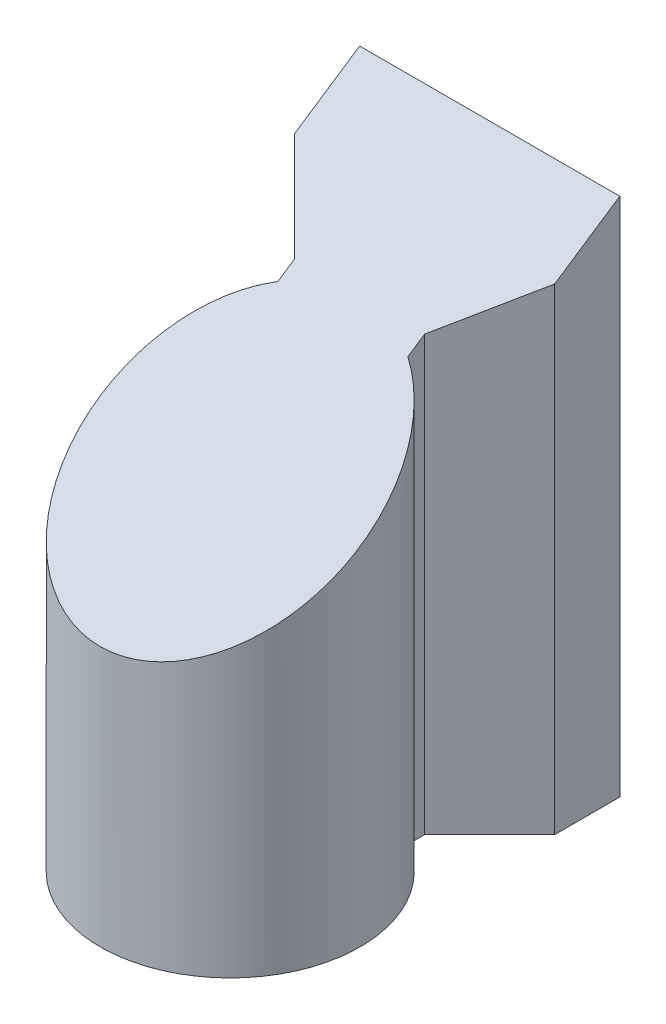
from build123d import *

# Parameters (mm, degrees)
EXTRUDE_1_DEPTH     = 40
CUT_EXTRUDE_1_DEPTH = 40


with BuildPart() as part:
    # 草图1 → 凸台-拉伸1 (new body)
    with BuildSketch(Plane(origin=(0, 0, 0), x_dir=(1, 0, 0), z_dir=(0, 1, 0))):
        with BuildLine():
            Line((0, 19.95), (10, 19.95))
            Line((10, 19.95), (10, 14.95))
            Line((10, 14.95), (5, 9.947267065))
            Line((5, 9.947267065), (5, 8.660254038))
            ThreePointArc((5, 8.660254038), (0, -10), (-5, 8.660254038))
            Line((-5, 8.660254038), (-5, 9.947267065))
            Line((-5, 9.947267065), (-10, 14.95))
            Line((-10, 14.95), (-10, 19.95))
            Line((-10, 19.95), (0, 19.95))
        make_face()
    extrude(amount=EXTRUDE_1_DEPTH)

    # 草图3 → 切除-拉伸1 (cut)
    with BuildSketch(Plane.ZY.offset(10)):
        Polygon((10, 20), (-19.95, 40), (10, 40), align=None)
    extrude(amount=-CUT_EXTRUDE_1_DEPTH, mode=Mode.SUBTRACT)


solid = part.part
